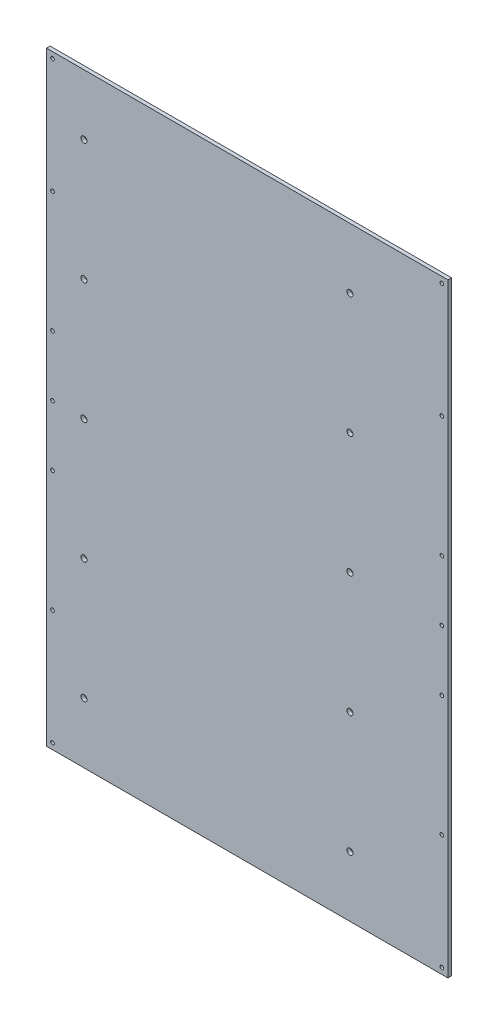
from build123d import *

# Parameters (mm, degrees)
SKETCH_1_W      = 332
SKETCH_1_H      = 500
SKETCH_1_R      = 1.5
SKETCH_1_R_2    = 2.5
EXTRUDE_1_DEPTH = 3


with BuildPart() as part:
    # 草图1 → 凸台-拉伸1 (new body)
    with BuildSketch(Plane.XY):
        with Locations((166, 250)):
            Rectangle(SKETCH_1_W, SKETCH_1_H)
        with Locations((327, 250)):
            Circle(SKETCH_1_R, mode=Mode.SUBTRACT)
        with Locations((327, 300)):
            Circle(SKETCH_1_R, mode=Mode.SUBTRACT)
        with Locations((327, 400)):
            Circle(SKETCH_1_R, mode=Mode.SUBTRACT)
        with Locations((327, 495)):
            Circle(SKETCH_1_R, mode=Mode.SUBTRACT)
        with Locations(Location((327, 5, 0), (0, 0, 180))):
            Circle(SKETCH_1_R, mode=Mode.SUBTRACT)
        with Locations(Location((327, 100, 0), (0, 0, 180))):
            Circle(SKETCH_1_R, mode=Mode.SUBTRACT)
        with Locations(Location((327, 200, 0), (0, 0, 180))):
            Circle(SKETCH_1_R, mode=Mode.SUBTRACT)
        with Locations((5, 200)):
            Circle(SKETCH_1_R, mode=Mode.SUBTRACT)
        with Locations((5, 100)):
            Circle(SKETCH_1_R, mode=Mode.SUBTRACT)
        with Locations((5, 5)):
            Circle(SKETCH_1_R, mode=Mode.SUBTRACT)
        with Locations(Location((5, 495, 0), (0, 0, 180))):
            Circle(SKETCH_1_R, mode=Mode.SUBTRACT)
        with Locations(Location((5, 400, 0), (0, 0, 180))):
            Circle(SKETCH_1_R, mode=Mode.SUBTRACT)
        with Locations(Location((5, 300, 0), (0, 0, 180))):
            Circle(SKETCH_1_R, mode=Mode.SUBTRACT)
        with Locations(Location((5, 250, 0), (0, 0, 180))):
            Circle(SKETCH_1_R, mode=Mode.SUBTRACT)
        with Locations((251, 250)):
            Circle(SKETCH_1_R_2, mode=Mode.SUBTRACT)
        with Locations((251, 150)):
            Circle(SKETCH_1_R_2, mode=Mode.SUBTRACT)
        with Locations((251, 50)):
            Circle(SKETCH_1_R_2, mode=Mode.SUBTRACT)
        with Locations((251, 350)):
            Circle(SKETCH_1_R_2, mode=Mode.SUBTRACT)
        with Locations((251, 450)):
            Circle(SKETCH_1_R_2, mode=Mode.SUBTRACT)
        with Locations((31, 150)):
            Circle(SKETCH_1_R_2, mode=Mode.SUBTRACT)
        with Locations((31, 350)):
            Circle(SKETCH_1_R_2, mode=Mode.SUBTRACT)
        with Locations((31, 450)):
            Circle(SKETCH_1_R_2, mode=Mode.SUBTRACT)
        with Locations((31, 250)):
            Circle(SKETCH_1_R_2, mode=Mode.SUBTRACT)
        with Locations((31, 50)):
            Circle(SKETCH_1_R_2, mode=Mode.SUBTRACT)
    extrude(amount=EXTRUDE_1_DEPTH)


solid = part.part
